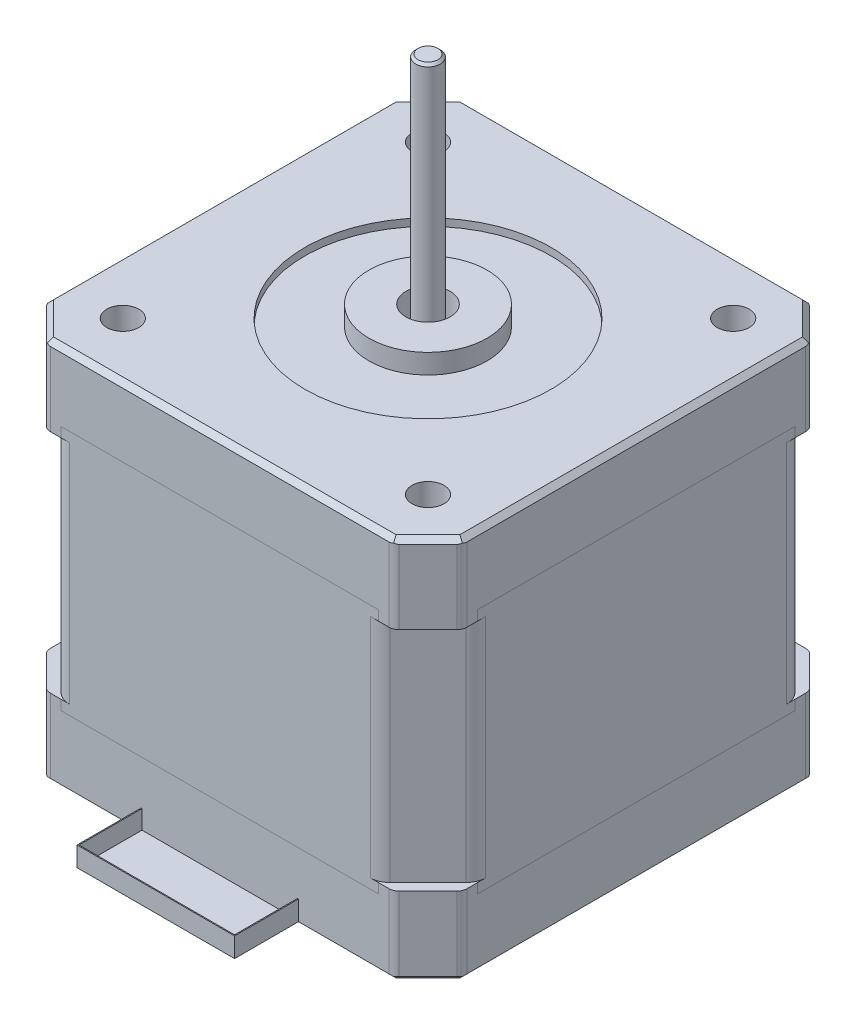
from build123d import *

# Parameters (mm, degrees)
BOSS_EXTRUDE1_DEPTH  = 8
SKETCH2_R            = 1.624765057
CUT_EXTRUDE1_DEPTH   = 6
CHAMFER1_SIZE        = 0.5
SKETCH3_W            = 32.228932188
SKETCH3_H            = 1
CUT_EXTRUDE2_DEPTH   = 48.964700562
SKETCH4_W            = 32.228932188
SKETCH4_H            = 1
CUT_EXTRUDE3_DEPTH   = 48.964700562
CUT_EXTRUDE4_DEPTH   = 1
MIRROR2_COPY_1_DEPTH = 1
BOSS_EXTRUDE2_DEPTH  = 24
BOSS_EXTRUDE4_DEPTH  = 8
SKETCH22_W           = 16
SKETCH22_H           = 2.5
BOSS_EXTRUDE5_DEPTH  = 6.5
CHAMFER3_SIZE        = 0.5
SKETCH23_W           = 15.8
SKETCH23_H           = 6.4
CUT_EXTRUDE5_DEPTH   = 1.9
SKETCH24_R           = 12.5
CUT_EXTRUDE6_DEPTH   = 0.75
SKETCH25_R           = 6
BOSS_EXTRUDE6_DEPTH  = 2
SKETCH26_R           = 2.25
CUT_EXTRUDE7_DEPTH   = 5
SKETCH27_R           = 1.25207439
BOSS_EXTRUDE7_DEPTH  = 27
CHAMFER5_SIZE        = 0.25
FILLET1_R            = 2
FILLET3_R            = 1
FILLET4_R            = 1


with BuildPart() as part:
    # Sketch1 → Boss-Extrude1 (new body)
    with BuildSketch(Plane(origin=(0, 0, 0), x_dir=(1, 0, 0), z_dir=(0, 1, 0))):
        Polygon((-21.15, -17.614466094), (-21.15, 17.614466094), (-17.614466094, 21.15), (17.614466094, 21.15), (21.15, 17.614466094), (21.15, -17.614466094), (17.614466094, -21.15), (-17.614466094, -21.15), align=None)
    extrude(amount=-BOSS_EXTRUDE1_DEPTH)

    # Sketch2 → Cut-Extrude1 (cut)
    with BuildSketch(Plane(origin=(0, 0, 0), x_dir=(1, 0, 0), z_dir=(0, 1, 0))):
        with Locations(Location((-15.5, 15.5, 0), (0, 0, 270))):
            Circle(SKETCH2_R)
        with Locations(Location((15.5, 15.5, 0), (0, 0, 90))):
            Circle(SKETCH2_R)
        with Locations(Location((15.5, -15.5, 0), (0, 0, 270))):
            Circle(SKETCH2_R)
        with Locations(Location((-15.5, -15.5, 0), (0, 0, 90))):
            Circle(SKETCH2_R)
    extrude(amount=-CUT_EXTRUDE1_DEPTH, mode=Mode.SUBTRACT)

    # Chamfer1
    chamfer1_edges = [part.edges().sort_by_distance(p)[0] for p in [
        (21.15, 0, 0),
        (19.382233047, 0, 19.382233047),
        (0, 0, 21.15),
        (-19.382233047, 0, 19.382233047),
        (-21.15, 0, 0),
        (-19.382233047, 0, -19.382233047),
        (0, 0, -21.15),
        (19.382233047, 0, -19.382233047),
    ]]
    chamfer(chamfer1_edges, length=CHAMFER1_SIZE)

    # Sketch3 → Cut-Extrude2 (cut, through all)
    with BuildSketch(Plane(origin=(21.15, 0, 0), x_dir=(0, 0, -1), z_dir=(1, 0, 0))):
        with Locations((0, -7.5)):
            Rectangle(SKETCH3_W, SKETCH3_H)
    extrude(amount=-CUT_EXTRUDE2_DEPTH, mode=Mode.SUBTRACT)

    # Sketch4 → Cut-Extrude3 (cut, through all)
    with BuildSketch(Plane.XY.offset(21.15)):
        with Locations((0, -7.5)):
            Rectangle(SKETCH4_W, SKETCH4_H)
    extrude(amount=-CUT_EXTRUDE3_DEPTH, mode=Mode.SUBTRACT)

    # Sketch5 → Cut-Extrude4 (cut)
    with BuildSketch(Plane.XZ.offset(8)):
        Polygon((-21.15, 16.114466094), (-16.114466094, 21.15), (-16.114466094, 16.114466094), align=None)
    cut_extrude4 = extrude(amount=-CUT_EXTRUDE4_DEPTH, mode=Mode.SUBTRACT)

    # Mirror1: Cut-Extrude4 across plane
    add(cut_extrude4.mirror(Plane(origin=(0, 0, 0), x_dir=(0, 0, 1), z_dir=(1, 0, 0))), mode=Mode.SUBTRACT)

    # Mirror2: Cut-Extrude4 across plane
    add(cut_extrude4.mirror(Plane.XY), mode=Mode.SUBTRACT)

    # Mirror2 copy 1 sketch → Mirror2 copy 1 (cut)
    with BuildSketch(Plane(origin=(0, -8, 0), x_dir=(-1, 0, 0), z_dir=(0, -1, 0))):
        Polygon((-21.15, 16.114466094), (-16.114466094, 21.15), (-16.114466094, 16.114466094), align=None)
    extrude(amount=-MIRROR2_COPY_1_DEPTH, mode=Mode.SUBTRACT)

    # Sketch6 → Boss-Extrude2 (add)
    with BuildSketch(Plane.XZ.offset(7)):
        Polygon((-21.15, -16.114466094), (-21.15, 16.114466094), (-16.114466094, 21.15), (16.114466094, 21.15), (21.15, 16.114466094), (21.15, -16.114466094), (16.114466094, -21.15), (-16.114466094, -21.15), align=None)
    extrude(amount=BOSS_EXTRUDE2_DEPTH)

    # Sketch16 → Boss-Extrude4 (add)
    with BuildSketch(Plane.XZ.offset(31)):
        Polygon((-21.15, -17.614466094), (-21.15, 17.614466094), (-17.614466094, 21.15), (17.614466094, 21.15), (21.15, 17.614466094), (21.15, -17.614466094), (17.614466094, -21.15), (-17.614466094, -21.15), align=None)
    extrude(amount=BOSS_EXTRUDE4_DEPTH)

    # Sketch22 → Boss-Extrude5 (add)
    with BuildSketch(Plane.XY.offset(21.15)):
        with Locations((0, -37.75)):
            Rectangle(SKETCH22_W, SKETCH22_H)
    extrude(amount=BOSS_EXTRUDE5_DEPTH)

    # Chamfer3
    chamfer3_edges = [part.edges().sort_by_distance(p)[0] for p in [
        (-19.382233047, -39, -19.382233047),
        (0, -39, -21.15),
        (19.382233047, -39, -19.382233047),
        (21.15, -39, 0),
        (19.382233047, -39, 19.382233047),
        (12.807233047, -39, 21.15),
        (-19.382233047, -39, 19.382233047),
        (-21.15, -39, 0),
        (-12.807233047, -39, 21.15),
        (-8, -39, 24.4),
        (8, -39, 24.4),
        (0, -39, 27.65),
    ]]
    chamfer(chamfer3_edges, length=CHAMFER3_SIZE)

    # Sketch23 → Cut-Extrude5 (cut)
    with BuildSketch(Plane(origin=(0, -36.5, 0), x_dir=(1, 0, 0), z_dir=(0, 1, 0))):
        with Locations((0, -24.35)):
            Rectangle(SKETCH23_W, SKETCH23_H)
    extrude(amount=-CUT_EXTRUDE5_DEPTH, mode=Mode.SUBTRACT)

    # Sketch24 → Cut-Extrude6 (cut)
    with BuildSketch(Plane(origin=(0, 0, 0), x_dir=(1, 0, 0), z_dir=(0, 1, 0))):
        with Locations(Location((0, 0, 0), (0, 0, 270))):
            Circle(SKETCH24_R)
    extrude(amount=-CUT_EXTRUDE6_DEPTH, mode=Mode.SUBTRACT)

    # Sketch25 → Boss-Extrude6 (add)
    with BuildSketch(Plane(origin=(0, -0.75, 0), x_dir=(1, 0, 0), z_dir=(0, 1, 0))):
        with Locations(Location((0, 0, 0), (0, 0, 270))):
            Circle(SKETCH25_R)
    extrude(amount=BOSS_EXTRUDE6_DEPTH)

    # Sketch26 → Cut-Extrude7 (cut)
    with BuildSketch(Plane(origin=(0, 1.25, 0), x_dir=(1, 0, 0), z_dir=(0, 1, 0))):
        with Locations(Location((0, 0, 0), (0, 0, 270))):
            Circle(SKETCH26_R)
    extrude(amount=-CUT_EXTRUDE7_DEPTH, mode=Mode.SUBTRACT)

    # Sketch27 → Boss-Extrude7 (add)
    with BuildSketch(Plane(origin=(0, -3.75, 0), x_dir=(1, 0, 0), z_dir=(0, 1, 0))):
        with Locations(Location((0, 0, 0), (0, 0, 270))):
            Circle(SKETCH27_R)
    extrude(amount=BOSS_EXTRUDE7_DEPTH)

    # Chamfer5
    chamfer5_edges = [part.edges().sort_by_distance(p)[0] for p in [
        (0, 23.25, -1.25207439),
    ]]
    chamfer(chamfer5_edges, length=CHAMFER5_SIZE)

    # Fillet1
    fillet1_edges = [part.edges().sort_by_distance(p)[0] for p in [
        (-21.15, -19.5, -16.114466094),
        (-16.114466094, -19.5, -21.15),
        (16.114466094, -19.5, -21.15),
        (21.15, -19.5, -16.114466094),
        (21.15, -19.5, 16.114466094),
        (16.114466094, -19.5, 21.15),
        (-16.114466094, -19.5, 21.15),
        (-21.15, -19.5, 16.114466094),
    ]]
    fillet(fillet1_edges, radius=FILLET1_R)

    # Fillet3
    fillet3_edges = [part.edges().sort_by_distance(p)[0] for p in [
        (-21.15, -4.25, 17.614466094),
        (-21.15, -4.25, -17.614466094),
        (-17.614466094, -4.25, -21.15),
        (17.614466094, -4.25, -21.15),
        (21.15, -4.25, -17.614466094),
        (21.15, -4.25, 17.614466094),
        (17.614466094, -4.25, 21.15),
        (-17.614466094, -4.25, 21.15),
    ]]
    fillet(fillet3_edges, radius=FILLET3_R)

    # Fillet4
    fillet4_edges = [part.edges().sort_by_distance(p)[0] for p in [
        (-21.15, -34.75, -17.614466094),
        (-21.15, -34.75, 17.614466094),
        (-17.614466094, -34.75, 21.15),
        (17.614466094, -34.75, 21.15),
        (21.15, -34.75, 17.614466094),
        (21.15, -34.75, -17.614466094),
        (17.614466094, -34.75, -21.15),
        (-17.614466094, -34.75, -21.15),
    ]]
    fillet(fillet4_edges, radius=FILLET4_R)


solid = part.part
